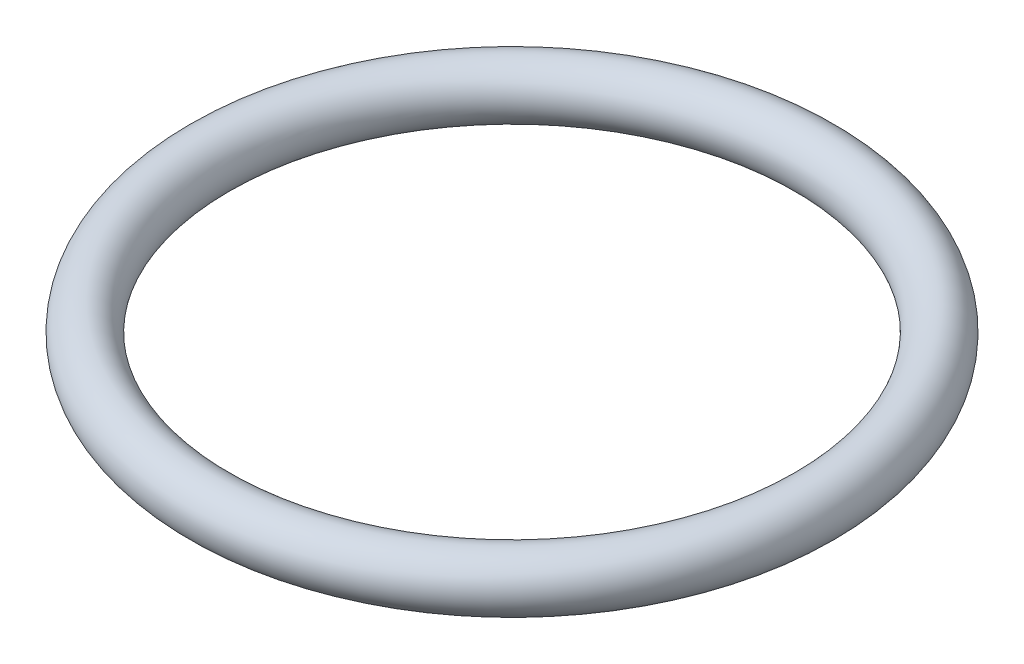
from build123d import *

# Parameters (mm, degrees)
SKETCH_2_R = 10


with BuildPart() as part:
    # 扫描1: sweep along a path in 草图4
    with BuildLine(Plane(origin=(0, 0, 0), x_dir=(1, 0, 0), z_dir=(0, 1, 0))) as sweep_1_path:
        CenterArc((-110, 0), 110, 0, 360)
    # 草图2 → 扫描1 (sweep)
    with BuildSketch(Plane.XY):
        Circle(SKETCH_2_R)
    sweep(path=sweep_1_path.line)


solid = part.part
